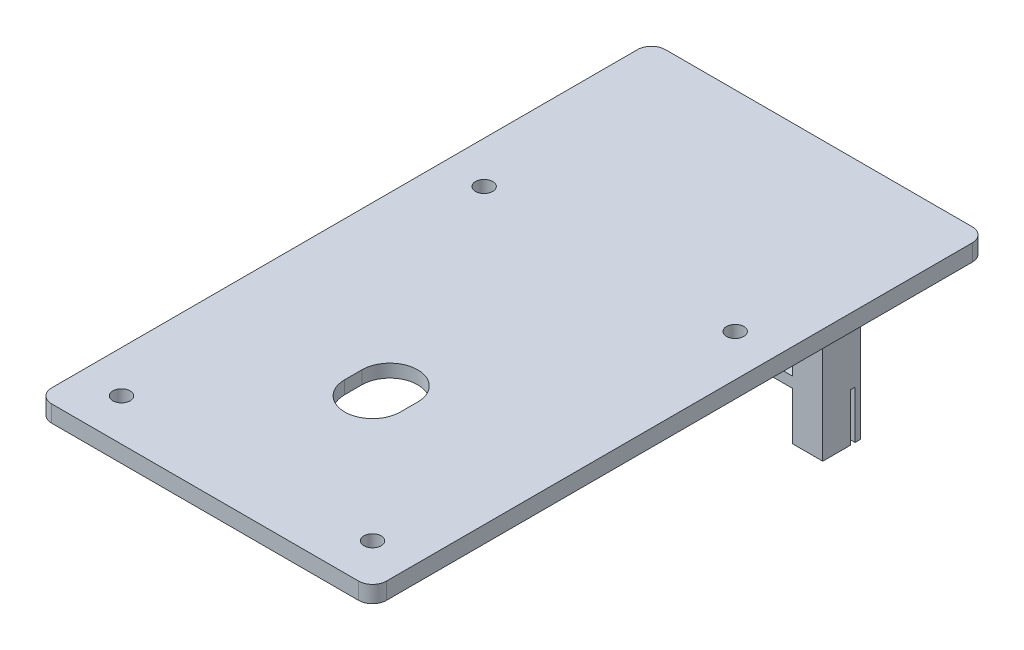
from build123d import *

# Parameters (mm, degrees)
SKETCH1_W           = 60
SKETCH1_H           = 110
BOSS_EXTRUDE1_DEPTH = 3
SKETCH2_R           = 1.55
CUT_EXTRUDE1_DEPTH  = 3
CUT_EXTRUDE2_DEPTH  = 2.33
CUT_EXTRUDE3_DEPTH  = 0.67
BOSS_EXTRUDE3_DEPTH = 25
SKETCH9_W           = 45
SKETCH9_H           = 6.8
BOSS_EXTRUDE4_DEPTH = 2
SKETCH10_W          = 5.4
SKETCH10_H          = 6.8
BOSS_EXTRUDE5_DEPTH = 14.5
FILLET1_R           = 2.5
SKETCH11_R          = 0.75
BOSS_EXTRUDE6_DEPTH = 6
SKETCH12_W          = 1.2
SKETCH12_H          = 0.8
CUT_EXTRUDE4_DEPTH  = 0.1


with BuildPart() as part:
    # Sketch1 → Boss-Extrude1 (new body)
    with BuildSketch(Plane(origin=(0, 0, 0), x_dir=(1, 0, 0), z_dir=(0, 1, 0))):
        with Locations((30, 55)):
            Rectangle(SKETCH1_W, SKETCH1_H)
    extrude(amount=BOSS_EXTRUDE1_DEPTH)

    # Sketch2 → Cut-Extrude1 (cut)
    with BuildSketch(Plane(origin=(0, 3, 0), x_dir=(1, 0, 0), z_dir=(0, 1, 0))):
        with Locations(Location((7.5, 7.5, 0), (0, 0, 270))):
            Circle(SKETCH2_R)
        with Locations(Location((52.5, 7.5, 0), (0, 0, 270))):
            Circle(SKETCH2_R)
        with Locations(Location((7.5, 72.5, 0), (0, 0, 270))):
            Circle(SKETCH2_R)
        with Locations(Location((52.5, 72.5, 0), (0, 0, 270))):
            Circle(SKETCH2_R)
    extrude(amount=-CUT_EXTRUDE1_DEPTH, mode=Mode.SUBTRACT)

    # Sketch3 → Cut-Extrude2 (cut)
    with BuildSketch(Plane(origin=(0, 3, 0), x_dir=(1, 0, 0), z_dir=(0, 1, 0))):
        with BuildLine():
            Line((35, 33.1), (35, 30))
            ThreePointArc((35, 30), (30, 25), (25, 30))
            Line((25, 30), (25, 33.1))
            ThreePointArc((25, 33.1), (30, 38.1), (35, 33.1))
        make_face()
    extrude(amount=-CUT_EXTRUDE2_DEPTH, mode=Mode.SUBTRACT)

    # Sketch4 → Cut-Extrude3 (cut)
    with BuildSketch(Plane.XZ):
        with BuildLine():
            Line((26.98, -20.051339235), (33.02, -20.051339235))
            ThreePointArc((33.02, -20.051339235), (38.181879503, -22.189459733), (40.32, -27.351339235))
            Line((40.32, -27.351339235), (40.32, -35.65))
            ThreePointArc((40.32, -35.65), (38.181879503, -40.811879503), (33.02, -42.95))
            Line((33.02, -42.95), (26.980030862, -42.930691587))
            ThreePointArc((26.980030862, -42.930691587), (21.840512337, -40.791632856), (19.703396192, -35.65130626))
            Line((19.703396192, -35.65130626), (19.68, -27.351339235))
            ThreePointArc((19.68, -27.351339235), (21.818120497, -22.189459733), (26.98, -20.051339235))
        make_face()
    extrude(amount=-CUT_EXTRUDE3_DEPTH, mode=Mode.SUBTRACT)

    # Sketch6 → Boss-Extrude3 (add)
    with BuildSketch(Plane.XZ):
        Polygon((51.3, -93.2), (52.5, -93.2), (52.5, -88.2), (47.1, -88.2), (47.1, -93.2), (48.3, -93.2), (48.3, -94), (47.1, -94), (47.1, -95), (52.5, -95), (52.5, -94), (51.3, -94), align=None)
        Polygon((11.7, -93.2), (12.9, -93.2), (12.9, -88.2), (7.5, -88.2), (7.5, -93.2), (8.7, -93.2), (8.7, -94), (7.5, -94), (7.5, -95), (12.9, -95), (12.9, -94), (11.7, -94), align=None)
    extrude(amount=BOSS_EXTRUDE3_DEPTH)

    # Sketch9 → Boss-Extrude4 (add)
    with BuildSketch(Plane(origin=(0, -16.5, 0), x_dir=(1, 0, 0), z_dir=(0, 1, 0))):
        with Locations((30, 91.6)):
            Rectangle(SKETCH9_W, SKETCH9_H)
    extrude(amount=BOSS_EXTRUDE4_DEPTH)

    # Sketch10 → Boss-Extrude5 (add)
    with BuildSketch(Plane.XZ):
        with Locations((10.2, -91.6)):
            Rectangle(SKETCH10_W, SKETCH10_H)
        with Locations((49.8, -91.6)):
            Rectangle(SKETCH10_W, SKETCH10_H)
    extrude(amount=BOSS_EXTRUDE5_DEPTH)

    # Fillet1
    fillet1_edges = [part.edges().sort_by_distance(p)[0] for p in [
        (0, 1.5, -110),
        (60, 1.5, -110),
        (60, 1.5, 0),
        (0, 1.5, 0),
    ]]
    fillet(fillet1_edges, radius=FILLET1_R)

    # Sketch11 → Boss-Extrude6 (add)
    with BuildSketch(Plane.XZ):
        with Locations(Location((30, -18.551339235, 0), (0, 0, 270))):
            Circle(SKETCH11_R)
        with Locations(Location((30, -44.940355963, 0), (0, 0, 270))):
            Circle(SKETCH11_R)
    extrude(amount=BOSS_EXTRUDE6_DEPTH)

    # Sketch12 → Cut-Extrude4 (cut)
    with BuildSketch(Plane.XZ.offset(16.5)):
        Polygon((12.9, -94), (12.9, -95), (47.1, -95), (47.1, -94), (48.3, -94), (48.3, -93.2), (47.1, -93.2), (47.1, -88.2), (12.9, -88.2), (12.9, -93.2), (11.7, -93.2), (11.7, -94), align=None)
        with Locations((8.1, -93.6)):
            Rectangle(SKETCH12_W, SKETCH12_H)
        with Locations((51.9, -93.6)):
            Rectangle(SKETCH12_W, SKETCH12_H)
    extrude(amount=-CUT_EXTRUDE4_DEPTH, mode=Mode.SUBTRACT)


solid = part.part
